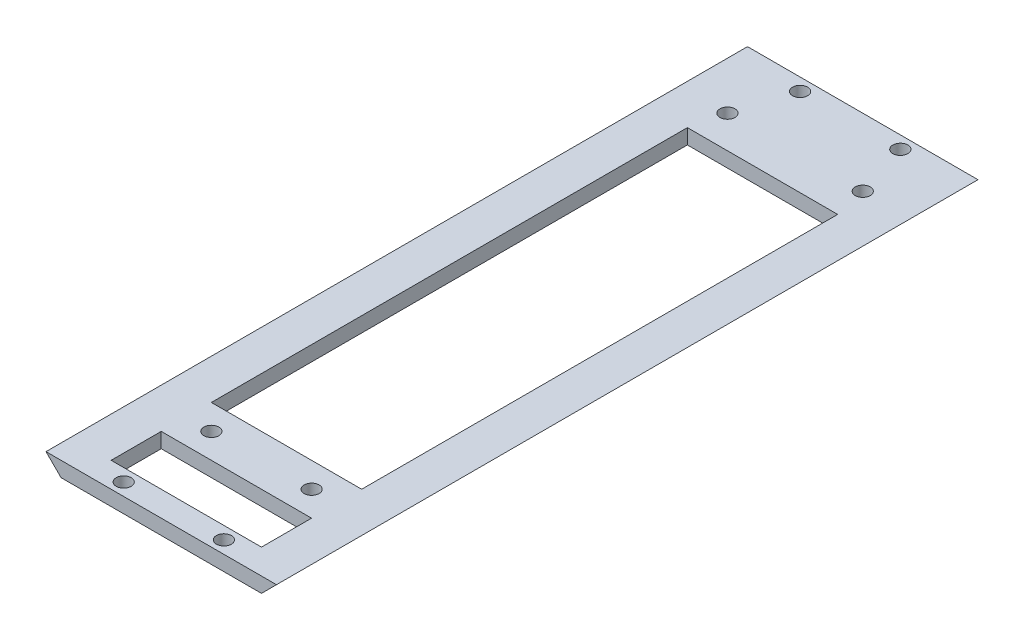
from build123d import *

# Parameters (mm, degrees)
SKETCH1_W           = 50
SKETCH1_H           = 140
BOSS_EXTRUDE2_DEPTH = 5
CUT_EXTRUDE1_DEPTH  = 152
SKETCH7_W           = 50
SKETCH7_H           = 2
CUT_EXTRUDE5_DEPTH  = 197
SKETCH8_W           = 30
SKETCH8_H           = 130
CUT_EXTRUDE6_DEPTH  = 197
SKETCH9_W           = 40
SKETCH9_H           = 20
SKETCH9_R           = 1.5
BOSS_EXTRUDE5_DEPTH = 3
SKETCH10_W          = 30
SKETCH10_H          = 10
SKETCH10_R          = 1.5
BOSS_EXTRUDE6_DEPTH = 3
SKETCH11_R          = 1.5
CUT_EXTRUDE7_DEPTH  = 3


with BuildPart() as part:
    # Sketch1 → Boss-Extrude2 (new body)
    with BuildSketch(Plane(origin=(0, 0, 0), x_dir=(1, 0, 0), z_dir=(0, 1, 0))):
        Rectangle(SKETCH1_W, SKETCH1_H)
    extrude(amount=BOSS_EXTRUDE2_DEPTH)

    # Sketch2 → Cut-Extrude1 (cut)
    with BuildSketch(Plane.XY.offset(70)):
        Polygon((-20, 0), (-25, 5), (-25, 0), align=None)
        Polygon((25, 5), (20, 0), (25, 0), align=None)
    extrude(amount=-CUT_EXTRUDE1_DEPTH, mode=Mode.SUBTRACT)

    # Sketch7 → Cut-Extrude5 (cut)
    with BuildSketch(Plane(origin=(0, 0, -70), x_dir=(-1, 0, 0), z_dir=(0, 0, -1))):
        with Locations((0, 4)):
            Rectangle(SKETCH7_W, SKETCH7_H)
    extrude(amount=-CUT_EXTRUDE5_DEPTH, mode=Mode.SUBTRACT)

    # Sketch8 → Cut-Extrude6 (cut)
    with BuildSketch(Plane.XZ):
        Rectangle(SKETCH8_W, SKETCH8_H)
    extrude(amount=-CUT_EXTRUDE6_DEPTH, mode=Mode.SUBTRACT)

    # Sketch9 → Boss-Extrude5 (add)
    with BuildSketch(Plane.XZ):
        with Locations((0, -60)):
            Rectangle(SKETCH9_W, SKETCH9_H)
        with Locations(Location((-13.5, -56.5, 0), (0, 0, 270))):
            Circle(SKETCH9_R, mode=Mode.SUBTRACT)
        with Locations(Location((13.5, -56.5, 0), (0, 0, 90))):
            Circle(SKETCH9_R, mode=Mode.SUBTRACT)
    extrude(amount=-BOSS_EXTRUDE5_DEPTH)

    # Sketch10 → Boss-Extrude6 (add)
    with BuildSketch(Plane.XZ):
        with Locations((0, 50)):
            Rectangle(SKETCH10_W, SKETCH10_H)
        with Locations(Location((-10, 50, 0), (0, 0, 270))):
            Circle(SKETCH10_R, mode=Mode.SUBTRACT)
        with Locations(Location((10, 50, 0), (0, 0, 270))):
            Circle(SKETCH10_R, mode=Mode.SUBTRACT)
    extrude(amount=-BOSS_EXTRUDE6_DEPTH)

    # Sketch11 → Cut-Extrude7 (cut)
    with BuildSketch(Plane.XZ):
        with Locations(Location((-10, 67.5, 0), (0, 0, 270))):
            Circle(SKETCH11_R)
        with Locations(Location((10, 67.5, 0), (0, 0, 90))):
            Circle(SKETCH11_R)
        with Locations(Location((10, -67.5, 0), (0, 0, 270))):
            Circle(SKETCH11_R)
        with Locations(Location((-10, -67.5, 0), (0, 0, 90))):
            Circle(SKETCH11_R)
    extrude(amount=-CUT_EXTRUDE7_DEPTH, mode=Mode.SUBTRACT)


solid = part.part
